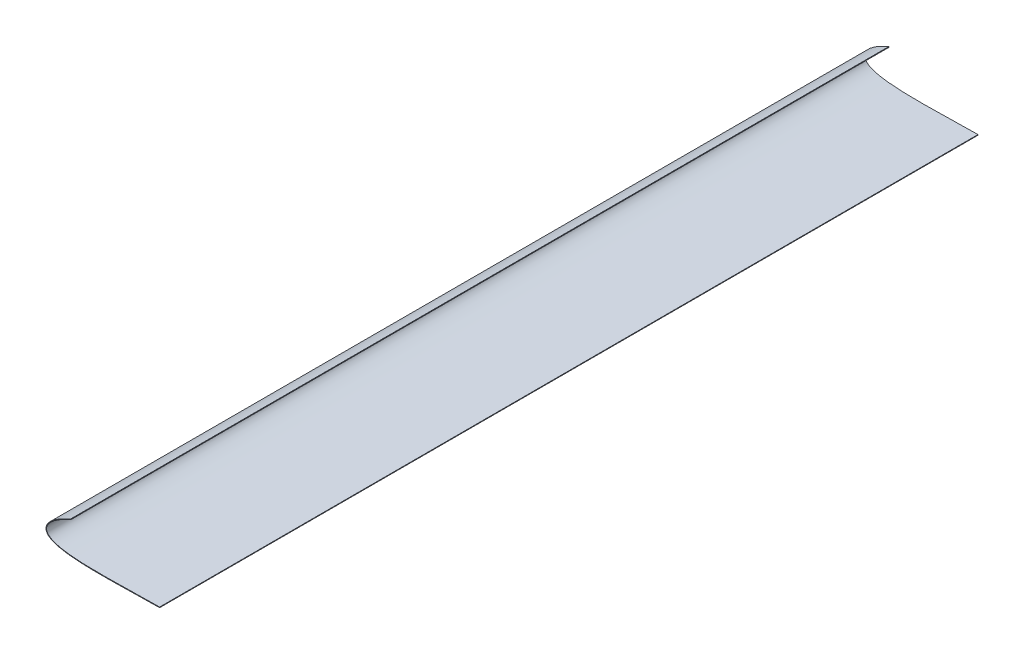
from build123d import *

# Parameters (mm, degrees)
BOSS_EXTRUDE1_DEPTH = 720.725


with BuildPart() as part:
    # Sketch2 → Boss-Extrude1 (new body)
    with BuildSketch(Plane.XY):
        with BuildLine():
            Line((52.450966591, 54.156690392), (52.279784263, 54.636849558))
            add(Edge.make_bspline(
                [(52.279784263, 54.636849558), (51.984237584, 54.511056821), (50.769870335, 53.98733611), (48.726284221, 53.036537204), (46.198596634, 51.785614981), (43.851395534, 50.562835734), (41.706522315, 49.275390999), (39.733394776, 48.029285981), (37.96601505, 46.750863313), (36.354256942, 45.554262029), (34.950604239, 44.324720652), (33.731005853, 43.137552945), (32.687540062, 41.964696774), (31.870049495, 40.795098076), (31.204908104, 39.656920775), (30.808603368, 38.519610424), (30.523569136, 37.434538913), (30.431008783, 36.362784079), (30.615024145, 35.329347542), (30.892786526, 34.31776167), (31.44961021, 33.393225815), (32.150652535, 32.523415034), (32.976658961, 31.650611998), (34.071745031, 30.944142433), (35.274330147, 30.214742482), (36.660691022, 29.558588434), (38.229863976, 28.979587438), (39.960327495, 28.409153359), (41.862111381, 27.907689258), (43.930829494, 27.476813607), (46.143058676, 27.054479883), (48.526108809, 26.711860726), (51.044567861, 26.394902704), (53.722663067, 26.066490372), (56.551232084, 25.916200458), (59.520788519, 25.669657839), (62.6352899, 25.564258659), (65.882911732, 25.378110786), (69.272721395, 25.311702125), (72.787592693, 25.244722742), (76.441016853, 25.21775368), (80.207956115, 25.205925557), (84.09958906, 25.254280801), (88.093376993, 25.234404524), (92.209483276, 25.367323441), (96.427933939, 25.370472209), (100.757397227, 25.449136698), (105.174516489, 25.554734077), (109.691566336, 25.647087119), (114.294867366, 25.736248002), (118.998236923, 25.802219339), (123.786466613, 25.937600392), (127.652050322, 25.978617474), (129.916088327, 26.006287555), (130.555209424, 26.014321885)],
                knots=[14.134429208, 14.134429208, 14.134429208, 14.134429208, 14.172367831, 14.290636843, 14.400564275, 14.505491459, 14.603093306, 14.695949765, 14.781006513, 14.860666874, 14.932933187, 15.001195019, 15.061639724, 15.117977566, 15.169575709, 15.216704545, 15.259669247, 15.302009247, 15.342390852, 15.383061745, 15.425174584, 15.468583505, 15.515143544, 15.566222682, 15.62172189, 15.681367848, 15.746954194, 15.819191005, 15.896502106, 15.979092178, 16.068736654, 16.162461377, 16.26337051, 16.36858172, 16.48100172, 16.59780172, 16.720476477, 16.848989655, 16.981977945, 17.120869917, 17.264217829, 17.413488104, 17.565776672, 17.723888673, 17.885150944, 18.052108822, 18.222096968, 18.396577658, 18.573966156, 18.755717098, 18.940376799, 19.129529928, 19.321463018, 19.396955855, 19.396955855, 19.396955855, 19.396955855], degree=3))
            Line((130.555209424, 26.014321885), (130.548667938, 26.534689034))
            add(Edge.make_bspline(
                [(52.450966591, 54.156690392), (52.331226703, 54.10460272), (52.211575134, 54.05231621), (48.598513497, 52.466209621), (45.148921663, 50.790800121), (39.569261895, 47.362088597), (37.29377419, 45.768666391), (33.64893293, 42.421797821), (32.150591155, 40.693937136), (30.974016316, 37.487201054), (30.841708434, 36.186315488), (31.636890757, 33.810556773), (32.494746255, 32.761333487), (34.364828507, 31.278960233), (35.385859188, 30.721401098), (37.422700797, 29.782300565), (38.50926311, 29.411592642), (41.888932576, 28.353918567), (44.253121805, 27.893924884), (49.005561472, 27.118358305), (51.404688059, 26.852581479), (58.633206362, 26.211091567), (63.469821915, 25.957744334), (73.154400086, 25.727718088), (77.996906352, 25.716461468), (92.764217068, 25.800424994), (102.66399777, 26.030813252), (118.563284111, 26.314315951), (124.555343757, 26.44910264), (130.548667938, 26.534689034)],
                knots=[14.135708649, 14.135708649, 14.135708649, 14.135708649, 14.151211266, 14.151211266, 14.60418364, 14.60418364, 14.932415743, 14.932415743, 15.199764537, 15.199764537, 15.36293217, 15.36293217, 15.526099802, 15.526099802, 15.662859963, 15.662859963, 15.799620124, 15.799620124, 16.08612483, 16.08612483, 16.372629537, 16.372629537, 16.94563895, 16.94563895, 17.518648363, 17.518648363, 18.689255122, 18.689255122, 19.396986742, 19.396986742, 19.396986742, 19.396986742], degree=3))
        make_face()
    extrude(amount=BOSS_EXTRUDE1_DEPTH)


solid = part.part
